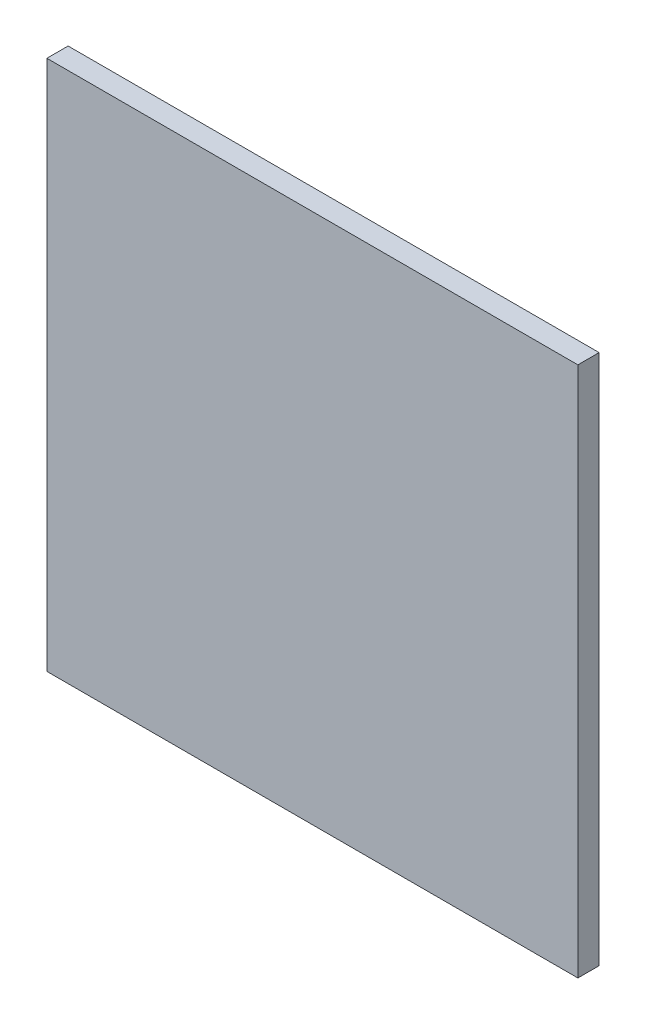
from build123d import *

# Parameters (mm, degrees)
SKETCH1_W           = 25.4
SKETCH1_H           = 25.4
BOSS_EXTRUDE1_DEPTH = 1.016


with BuildPart() as part:
    # Sketch1 → Boss-Extrude1 (new body)
    with BuildSketch(Plane.XY):
        with Locations((12.7, 12.7)):
            Rectangle(SKETCH1_W, SKETCH1_H)
    extrude(amount=BOSS_EXTRUDE1_DEPTH)


solid = part.part
